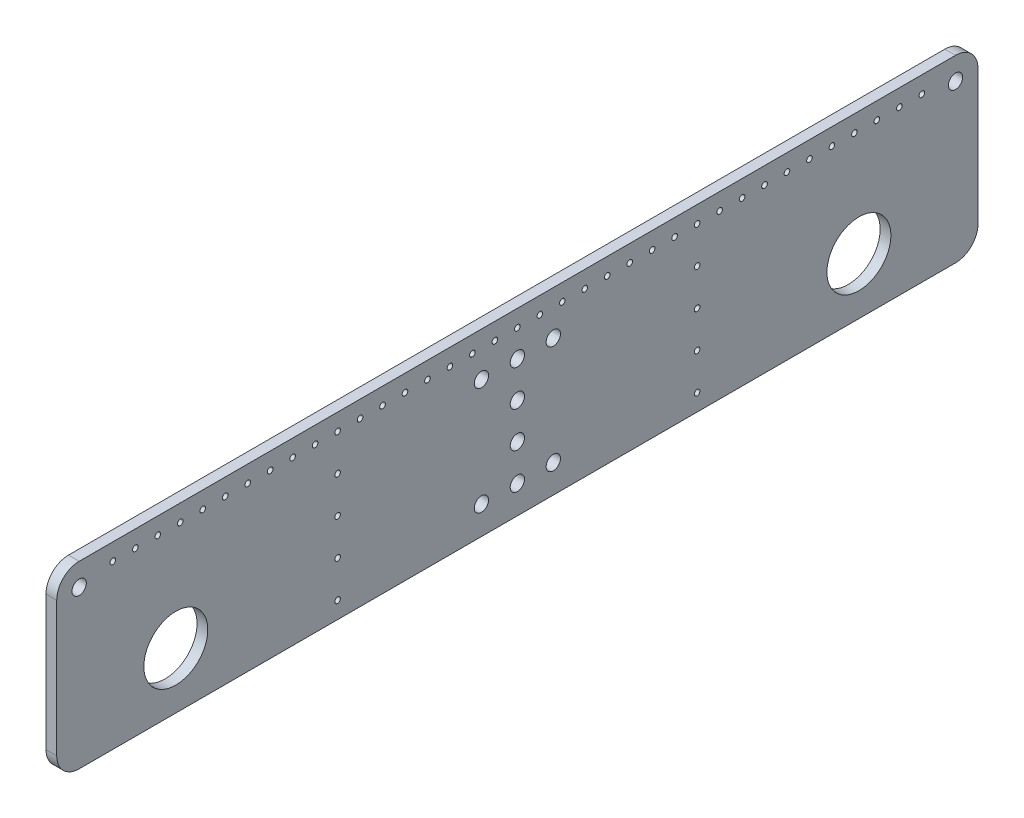
from build123d import *

# Parameters (mm, degrees)
SKETCH2_R           = 14.225
SKETCH2_R_2         = 3.18
SKETCH2_R_3         = 1.25
BOSS_EXTRUDE1_DEPTH = 4.7625


with BuildPart() as part:
    # Sketch2 → Boss-Extrude1 (new body)
    with BuildSketch(Plane(origin=(0, 0, 0), x_dir=(0, 0, -1), z_dir=(1, 0, 0))):
        with BuildLine():
            Line((-23.48132736, 28.668303571), (-23.48132736, -31.331696429))
            ThreePointArc((-23.48132736, -31.331696429), (-20.552395172, -38.40276424), (-13.48132736, -41.331696429))
            Line((-13.48132736, -41.331696429), (376.51867264, -41.331696429))
            ThreePointArc((376.51867264, -41.331696429), (383.589740452, -38.40276424), (386.51867264, -31.331696429))
            Line((386.51867264, -31.331696429), (386.51867264, 28.668303571))
            ThreePointArc((386.51867264, 28.668303571), (383.589740452, 35.739371383), (376.51867264, 38.668303571))
            Line((376.51867264, 38.668303571), (-13.48132736, 38.668303571))
            ThreePointArc((-13.48132736, 38.668303571), (-20.552395172, 35.739371383), (-23.48132736, 28.668303571))
        make_face()
        with Locations(Location((29.51867264, -16.331696429, 0), (0, 0, 180))):
            Circle(SKETCH2_R, mode=Mode.SUBTRACT)
        with Locations(Location((333.51867264, -16.331696429, 0), (0, 0, 180))):
            Circle(SKETCH2_R, mode=Mode.SUBTRACT)
        with Locations(Location((181.51867264, -28.771696429, 0), (0, 0, 180))):
            Circle(SKETCH2_R_2, mode=Mode.SUBTRACT)
        with Locations(Location((197.51867264, -28.771696429, 0), (0, 0, 180))):
            Circle(SKETCH2_R_2, mode=Mode.SUBTRACT)
        with Locations(Location((197.51867264, 19.228303571, 0), (0, 0, 180))):
            Circle(SKETCH2_R_2, mode=Mode.SUBTRACT)
        with Locations(Location((181.51867264, -12.771696429, 0), (0, 0, 180))):
            Circle(SKETCH2_R_2, mode=Mode.SUBTRACT)
        with Locations(Location((181.51867264, 3.228303571, 0), (0, 0, 180))):
            Circle(SKETCH2_R_2, mode=Mode.SUBTRACT)
        with Locations(Location((181.51867264, 19.228303571, 0), (0, 0, 180))):
            Circle(SKETCH2_R_2, mode=Mode.SUBTRACT)
        with Locations(Location((165.51867264, -28.771696429, 0), (0, 0, 180))):
            Circle(SKETCH2_R_2, mode=Mode.SUBTRACT)
        with Locations(Location((165.51867264, 19.228303571, 0), (0, 0, 180))):
            Circle(SKETCH2_R_2, mode=Mode.SUBTRACT)
        with Locations(Location((1.51867264, 31.168303571, 0), (0, 0, 180))):
            Circle(SKETCH2_R_3, mode=Mode.SUBTRACT)
        with Locations(Location((11.51867264, 31.168303571, 0), (0, 0, 180))):
            Circle(SKETCH2_R_3, mode=Mode.SUBTRACT)
        with Locations(Location((21.51867264, 31.168303571, 0), (0, 0, 180))):
            Circle(SKETCH2_R_3, mode=Mode.SUBTRACT)
        with Locations(Location((31.51867264, 31.168303571, 0), (0, 0, 180))):
            Circle(SKETCH2_R_3, mode=Mode.SUBTRACT)
        with Locations(Location((41.51867264, 31.168303571, 0), (0, 0, 180))):
            Circle(SKETCH2_R_3, mode=Mode.SUBTRACT)
        with Locations(Location((51.51867264, 31.168303571, 0), (0, 0, 180))):
            Circle(SKETCH2_R_3, mode=Mode.SUBTRACT)
        with Locations(Location((61.51867264, 31.168303571, 0), (0, 0, 180))):
            Circle(SKETCH2_R_3, mode=Mode.SUBTRACT)
        with Locations(Location((71.51867264, 31.168303571, 0), (0, 0, 180))):
            Circle(SKETCH2_R_3, mode=Mode.SUBTRACT)
        with Locations(Location((81.51867264, 31.168303571, 0), (0, 0, 180))):
            Circle(SKETCH2_R_3, mode=Mode.SUBTRACT)
        with Locations(Location((91.51867264, 31.168303571, 0), (0, 0, 180))):
            Circle(SKETCH2_R_3, mode=Mode.SUBTRACT)
        with Locations(Location((101.51867264, 31.168303571, 0), (0, 0, 180))):
            Circle(SKETCH2_R_3, mode=Mode.SUBTRACT)
        with Locations(Location((111.51867264, 31.168303571, 0), (0, 0, 180))):
            Circle(SKETCH2_R_3, mode=Mode.SUBTRACT)
        with Locations(Location((121.51867264, 31.168303571, 0), (0, 0, 180))):
            Circle(SKETCH2_R_3, mode=Mode.SUBTRACT)
        with Locations(Location((131.51867264, 31.168303571, 0), (0, 0, 180))):
            Circle(SKETCH2_R_3, mode=Mode.SUBTRACT)
        with Locations(Location((141.51867264, 31.168303571, 0), (0, 0, 180))):
            Circle(SKETCH2_R_3, mode=Mode.SUBTRACT)
        with Locations(Location((151.51867264, 31.168303571, 0), (0, 0, 180))):
            Circle(SKETCH2_R_3, mode=Mode.SUBTRACT)
        with Locations(Location((161.51867264, 31.168303571, 0), (0, 0, 180))):
            Circle(SKETCH2_R_3, mode=Mode.SUBTRACT)
        with Locations(Location((171.51867264, 31.168303571, 0), (0, 0, 180))):
            Circle(SKETCH2_R_3, mode=Mode.SUBTRACT)
        with Locations(Location((181.51867264, 31.168303571, 0), (0, 0, 180))):
            Circle(SKETCH2_R_3, mode=Mode.SUBTRACT)
        with Locations(Location((191.51867264, 31.168303571, 0), (0, 0, 180))):
            Circle(SKETCH2_R_3, mode=Mode.SUBTRACT)
        with Locations(Location((201.51867264, 31.168303571, 0), (0, 0, 180))):
            Circle(SKETCH2_R_3, mode=Mode.SUBTRACT)
        with Locations(Location((211.51867264, 31.168303571, 0), (0, 0, 180))):
            Circle(SKETCH2_R_3, mode=Mode.SUBTRACT)
        with Locations(Location((221.51867264, 31.168303571, 0), (0, 0, 180))):
            Circle(SKETCH2_R_3, mode=Mode.SUBTRACT)
        with Locations(Location((231.51867264, 31.168303571, 0), (0, 0, 180))):
            Circle(SKETCH2_R_3, mode=Mode.SUBTRACT)
        with Locations(Location((241.51867264, 31.168303571, 0), (0, 0, 180))):
            Circle(SKETCH2_R_3, mode=Mode.SUBTRACT)
        with Locations(Location((251.51867264, 31.168303571, 0), (0, 0, 180))):
            Circle(SKETCH2_R_3, mode=Mode.SUBTRACT)
        with Locations(Location((261.51867264, 31.168303571, 0), (0, 0, 180))):
            Circle(SKETCH2_R_3, mode=Mode.SUBTRACT)
        with Locations(Location((271.51867264, 31.168303571, 0), (0, 0, 180))):
            Circle(SKETCH2_R_3, mode=Mode.SUBTRACT)
        with Locations(Location((281.51867264, 31.168303571, 0), (0, 0, 180))):
            Circle(SKETCH2_R_3, mode=Mode.SUBTRACT)
        with Locations(Location((291.51867264, 31.168303571, 0), (0, 0, 180))):
            Circle(SKETCH2_R_3, mode=Mode.SUBTRACT)
        with Locations(Location((301.51867264, 31.168303571, 0), (0, 0, 180))):
            Circle(SKETCH2_R_3, mode=Mode.SUBTRACT)
        with Locations(Location((311.51867264, 31.168303571, 0), (0, 0, 180))):
            Circle(SKETCH2_R_3, mode=Mode.SUBTRACT)
        with Locations(Location((321.51867264, 31.168303571, 0), (0, 0, 180))):
            Circle(SKETCH2_R_3, mode=Mode.SUBTRACT)
        with Locations(Location((331.51867264, 31.168303571, 0), (0, 0, 180))):
            Circle(SKETCH2_R_3, mode=Mode.SUBTRACT)
        with Locations(Location((341.51867264, 31.168303571, 0), (0, 0, 180))):
            Circle(SKETCH2_R_3, mode=Mode.SUBTRACT)
        with Locations(Location((351.51867264, 31.168303571, 0), (0, 0, 180))):
            Circle(SKETCH2_R_3, mode=Mode.SUBTRACT)
        with Locations(Location((361.51867264, 31.168303571, 0), (0, 0, 180))):
            Circle(SKETCH2_R_3, mode=Mode.SUBTRACT)
        with Locations(Location((101.51867264, -33.831696429, 0), (0, 0, 180))):
            Circle(SKETCH2_R_3, mode=Mode.SUBTRACT)
        with Locations(Location((261.51867264, -33.831696429, 0), (0, 0, 180))):
            Circle(SKETCH2_R_3, mode=Mode.SUBTRACT)
        with Locations(Location((-13.48132736, 28.668303571, 0), (0, 0, 180))):
            Circle(SKETCH2_R_2, mode=Mode.SUBTRACT)
        with Locations(Location((376.51867264, 28.668303571, 0), (0, 0, 180))):
            Circle(SKETCH2_R_2, mode=Mode.SUBTRACT)
        with Locations(Location((101.51867264, -17.581696429, 0), (0, 0, 180))):
            Circle(SKETCH2_R_3, mode=Mode.SUBTRACT)
        with Locations(Location((261.51867264, -17.581696429, 0), (0, 0, 180))):
            Circle(SKETCH2_R_3, mode=Mode.SUBTRACT)
        with Locations(Location((101.51867264, -1.331696429, 0), (0, 0, 180))):
            Circle(SKETCH2_R_3, mode=Mode.SUBTRACT)
        with Locations(Location((261.51867264, -1.331696429, 0), (0, 0, 180))):
            Circle(SKETCH2_R_3, mode=Mode.SUBTRACT)
        with Locations(Location((101.51867264, 14.918303571, 0), (0, 0, 180))):
            Circle(SKETCH2_R_3, mode=Mode.SUBTRACT)
        with Locations(Location((261.51867264, 14.918303571, 0), (0, 0, 180))):
            Circle(SKETCH2_R_3, mode=Mode.SUBTRACT)
    extrude(amount=BOSS_EXTRUDE1_DEPTH)


solid = part.part
